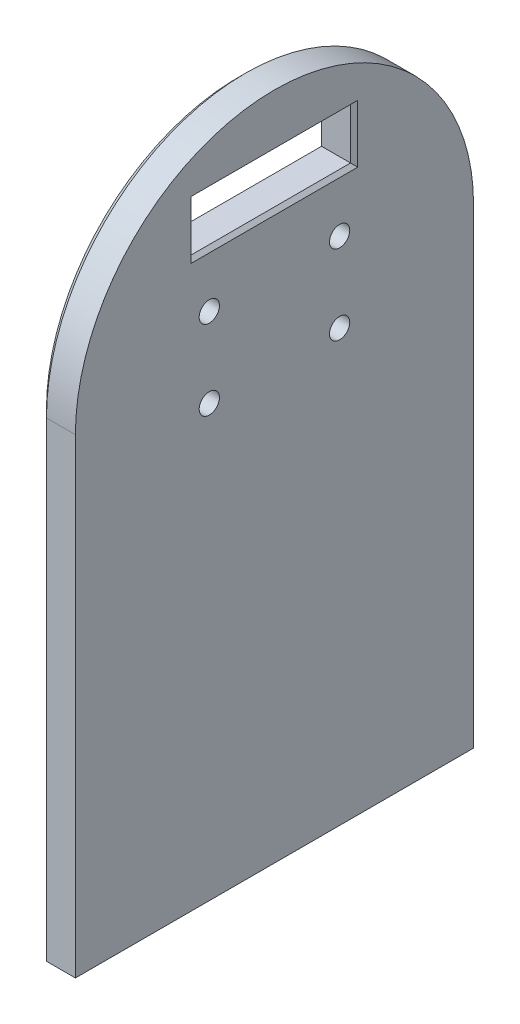
from build123d import *

# Parameters (mm, degrees)
EXTRUDE_1_DEPTH     = 5
SKETCH_2_R          = 1.4
CUT_EXTRUDE_1_DEPTH = 5
CHAMFER_1_SIZE      = 1
SKETCH_4_W          = 22
SKETCH_4_H          = 7
CUT_EXTRUDE_4_DEPTH = 10
CHAMFER_2_SIZE      = 0.5


with BuildPart() as part:
    # 草图1 → 凸台-拉伸1 (new body)
    with BuildSketch(Plane(origin=(0, 0, 0), x_dir=(0, 0, -1), z_dir=(1, 0, 0))):
        with BuildLine():
            Line((-27.5, 0), (-27.5, -65))
            Line((-27.5, -65), (27.5, -65))
            Line((27.5, -65), (27.5, 0))
            ThreePointArc((27.5, 0), (0, 27.5), (-27.5, 0))
        make_face()
    extrude(amount=EXTRUDE_1_DEPTH)

    # 草图2 → 切除-拉伸1 (cut)
    with BuildSketch(Plane(origin=(5, 0, 0), x_dir=(0, 0, -1), z_dir=(1, 0, 0))):
        with Locations((-9, 5.5)):
            Circle(SKETCH_2_R)
        with Locations((9, 5.5)):
            Circle(SKETCH_2_R)
        with Locations((9, -5.5)):
            Circle(SKETCH_2_R)
        with Locations((-9, -5.5)):
            Circle(SKETCH_2_R)
    extrude(amount=-CUT_EXTRUDE_1_DEPTH, mode=Mode.SUBTRACT)

    # 倒角1
    chamfer_1_edges = [part.edges().sort_by_distance(p)[0] for p in [
        (0, -32.5, -27.5),
        (0, -65, 0),
        (0, -32.5, 27.5),
        (0, 27.5, 0),
    ]]
    chamfer(chamfer_1_edges, length=CHAMFER_1_SIZE)

    # 草图4 → 切除-拉伸4 (cut)
    with BuildSketch(Plane.ZY):
        with Locations((0, 16.5)):
            Rectangle(SKETCH_4_W, SKETCH_4_H)
    extrude(amount=-CUT_EXTRUDE_4_DEPTH, mode=Mode.SUBTRACT)

    # 倒角2
    chamfer_2_edges = [part.edges().sort_by_distance(p)[0] for p in [
        (5, 16.5, -11),
        (5, 20, 0),
        (5, 16.5, 11),
        (5, 13, 0),
        (0, 16.5, -11),
        (0, 13, 0),
        (0, 16.5, 11),
        (0, 20, 0),
    ]]
    chamfer(chamfer_2_edges, length=CHAMFER_2_SIZE)


solid = part.part
